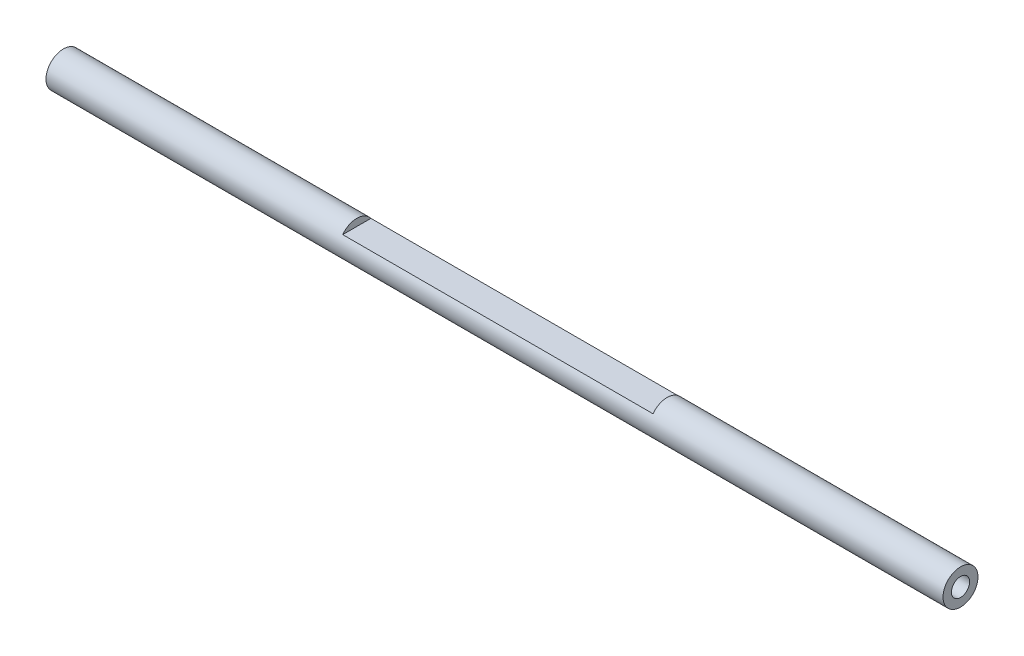
from build123d import *

# Parameters (mm, degrees)
SKETCH1_W               = 20
SKETCH1_H               = 16.9
BOSS_EXTRUDE1_DEPTH     = 23.75
SKETCH2_R               = 8.45
BOSS_EXTRUDE2_DEPTH     = 193.05
SKETCH6_R               = 18.45
SKETCH6_R_2             = 8.45
CUT_EXTRUDE_THIN1_DEPTH = 30
CUT_EXTRUDE1_START      = 5
SKETCH7_W               = 150
SKETCH7_H               = 40
CUT_EXTRUDE1_DEPTH      = 10


with BuildPart() as part:
    # Sketch1 → Boss-Extrude1 (new, symmetric)
    with BuildSketch(Plane(origin=(0, 0, 0), x_dir=(0, 0, -1), z_dir=(1, 0, 0))):
        Rectangle(SKETCH1_W, SKETCH1_H)
    extrude(amount=BOSS_EXTRUDE1_DEPTH, both=True)

    # Sketch2 → Boss-Extrude2 (add)
    with BuildSketch(Plane(origin=(23.75, 0, 0), x_dir=(0, 0, -1), z_dir=(1, 0, 0))):
        with Locations(Location((0, 0, 0), (0, 0, 270))):
            Circle(SKETCH2_R)
    boss_extrude2 = extrude(amount=BOSS_EXTRUDE2_DEPTH)

    # Sketch3 → M10x1.25 Tapped Hole1 (revolve, cut)
    with BuildSketch(Plane(origin=(216.8, 0, 0), x_dir=(0, 0, -1), z_dir=(0, 1, 0))):
        Polygon((0, 0), (0, 32.643786724), (4.4, 30), (4.4, 0), align=None)
    m10x1_25_tapped_hole1 = revolve(axis=Axis((223.15, 0, 0), (-1, 0, 0)), mode=Mode.SUBTRACT)

    # Mirror1: Boss-Extrude2, M10x1.25 Tapped Hole1 across plane
    add(boss_extrude2.mirror(Plane(origin=(0, 0, 0), x_dir=(0, 0, 1), z_dir=(1, 0, 0))))
    add(m10x1_25_tapped_hole1.mirror(Plane(origin=(0, 0, 0), x_dir=(0, 0, 1), z_dir=(1, 0, 0))), mode=Mode.SUBTRACT)

    # Sketch6 → Cut-Extrude-Thin1 (cut, symmetric)
    with BuildSketch(Plane(origin=(0, 0, 0), x_dir=(0, 0, -1), z_dir=(1, 0, 0))):
        Circle(SKETCH6_R)
        Circle(SKETCH6_R_2, mode=Mode.SUBTRACT)
    extrude(amount=CUT_EXTRUDE_THIN1_DEPTH, both=True, mode=Mode.SUBTRACT)

    # Sketch7 → Cut-Extrude1 (cut)
    with BuildSketch(Plane(origin=(0, 0, 0), x_dir=(1, 0, 0), z_dir=(0, 1, 0)).offset(CUT_EXTRUDE1_START)):
        Rectangle(SKETCH7_W, SKETCH7_H)
    extrude(amount=CUT_EXTRUDE1_DEPTH, mode=Mode.SUBTRACT)


solid = part.part
